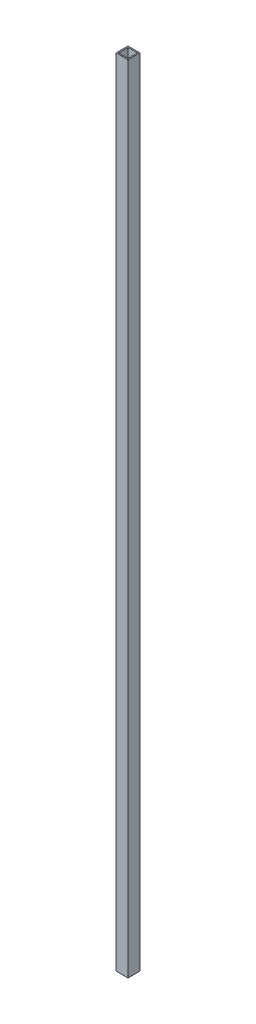
from build123d import *

# Parameters (mm, degrees)
SKETCH1_W           = 15
SKETCH1_H           = 15
SKETCH1_W_2         = 12
SKETCH1_H_2         = 12
BOSS_EXTRUDE1_DEPTH = 1000


with BuildPart() as part:
    # Sketch1 → Boss-Extrude1 (new body)
    with BuildSketch(Plane(origin=(0, 0, 0), x_dir=(1, 0, 0), z_dir=(0, 1, 0))):
        with Locations((7.5, 7.5)):
            Rectangle(SKETCH1_W, SKETCH1_H)
        with Locations((7.5, 7.5)):
            Rectangle(SKETCH1_W_2, SKETCH1_H_2, mode=Mode.SUBTRACT)
    extrude(amount=BOSS_EXTRUDE1_DEPTH)


solid = part.part
